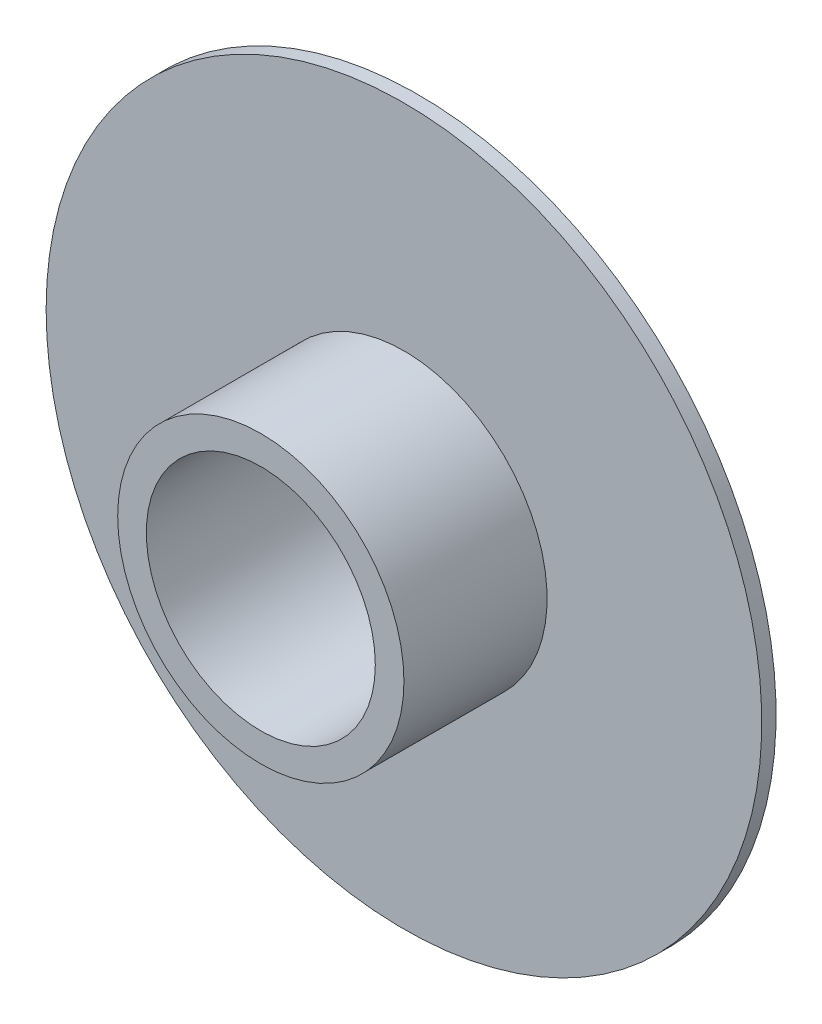
from build123d import *

# Parameters (mm, degrees)
SKETCH1_R           = 5
SKETCH1_R_2         = 4
BOSS_EXTRUDE1_DEPTH = 3
BOSS_EXTRUDE2_START = -0.5
SKETCH2_R           = 12.5
SKETCH2_R_2         = 5
BOSS_EXTRUDE2_DEPTH = 0.5


with BuildPart() as part:
    # Sketch1 → Boss-Extrude1 (new, symmetric)
    with BuildSketch(Plane.XY):
        Circle(SKETCH1_R)
        Circle(SKETCH1_R_2, mode=Mode.SUBTRACT)
    extrude(amount=BOSS_EXTRUDE1_DEPTH, both=True)

    # Sketch2 → Boss-Extrude2 (add)
    with BuildSketch(Plane(origin=(0, 0, -2.5), x_dir=(-1, 0, 0), z_dir=(0, 0, -1)).offset(BOSS_EXTRUDE2_START)):
        Circle(SKETCH2_R)
        Circle(SKETCH2_R_2, mode=Mode.SUBTRACT)
    extrude(amount=BOSS_EXTRUDE2_DEPTH)


solid = part.part
